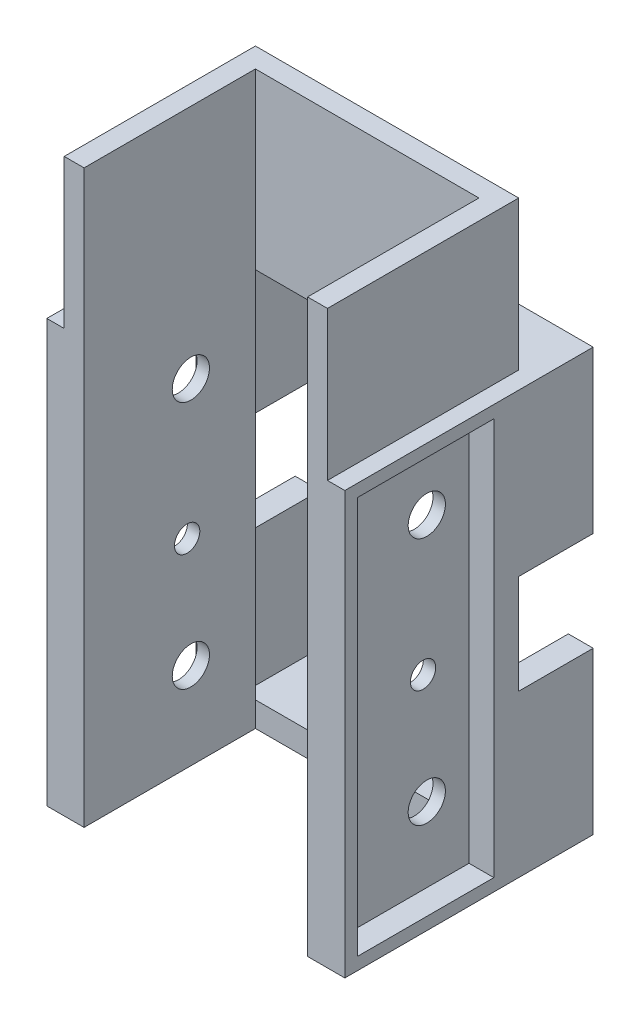
from build123d import *

# Parameters (mm, degrees)
BOSS_EXTRUDE1_DEPTH     = 60
CUT_EXTRUDE2_DEPTH      = 10
SKETCH4_R               = 1.5
CUT_EXTRUDE3_DEPTH      = 145.308696897
CUT_EXTRUDE4_DEPTH      = 188.082869339
CUT_EXTRUDE4_DEPTH_BACK = 188.082869339
SKETCH6_W               = 5
SKETCH6_H               = 59
BOSS_EXTRUDE2_DEPTH     = 150
SKETCH7_R               = 7.5
SKETCH7_R_2             = 5.1
CUT_EXTRUDE5_DEPTH      = 148.732867027
SKETCH9_W               = 40
SKETCH9_H               = 10
CUT_EXTRUDE6_DEPTH      = 188.082869339
SKETCH11_W              = 10
SKETCH11_H              = 40
BOSS_EXTRUDE6_DEPTH     = 160
SKETCH13_W              = 40
SKETCH13_H              = 30
CUT_EXTRUDE7_DEPTH      = 156.32224567
BOSS_EXTRUDE7_DEPTH     = 60


with BuildPart() as part:
    # Sketch1 → Boss-Extrude1 (new, symmetric)
    with BuildSketch(Plane.YZ):
        Polygon((85, 50), (85, -50), (75, -50), (75, 40), (-75, 40), (-75, -50), (-85, -50), (-85, 50), align=None)
    extrude(amount=BOSS_EXTRUDE1_DEPTH, both=True)

    # Sketch3 → Cut-Extrude2 (cut)
    with BuildSketch(Plane.YZ.offset(60)):
        Polygon((-80, 45), (-80, -50), (-75, -50), (-75, 40), (75, 40), (75, -50), (80, -50), (80, 45), align=None)
    cut_extrude2 = extrude(amount=-CUT_EXTRUDE2_DEPTH, mode=Mode.SUBTRACT)

    # Mirror1: Cut-Extrude2 across plane
    add(cut_extrude2.mirror(Plane(origin=(0, 0, 0), x_dir=(0, 0, 1), z_dir=(1, 0, 0))), mode=Mode.SUBTRACT)

    # Sketch4 → Cut-Extrude3 (cut, through all)
    with BuildSketch(Plane.XY.offset(50)):
        with Locations((-35, 0)):
            Circle(SKETCH4_R)
        with Locations((35, 0)):
            Circle(SKETCH4_R)
        with Locations((-35, 60)):
            Circle(SKETCH4_R)
        with Locations((35, 60)):
            Circle(SKETCH4_R)
    extrude(amount=-CUT_EXTRUDE3_DEPTH, mode=Mode.SUBTRACT)

    # Sketch5 → Cut-Extrude4 (cut, two sides: drawn at the far end of the back side and taken through both)
    with BuildSketch(Plane(origin=(0, 85, 0), x_dir=(-1, 0, 0), z_dir=(0, 1, 0)).offset(-CUT_EXTRUDE4_DEPTH_BACK)):
        Polygon((45, 50), (-45, 50), (-45, -19), (20, -19), (45, -19), align=None)
    extrude(amount=CUT_EXTRUDE4_DEPTH + CUT_EXTRUDE4_DEPTH_BACK, mode=Mode.SUBTRACT)

    # Sketch6 → Boss-Extrude2 (add)
    with BuildSketch(Plane.XZ.offset(-75)):
        with Locations((-47.5, 10.5)):
            Rectangle(SKETCH6_W, SKETCH6_H)
        with Locations((47.5, 10.5)):
            Rectangle(SKETCH6_W, SKETCH6_H)
    extrude(amount=BOSS_EXTRUDE2_DEPTH)

    # Sketch7 → Cut-Extrude5 (cut, through all)
    with BuildSketch(Plane(origin=(-50, 0, 0), x_dir=(0, -1, 0), z_dir=(-1, 0, 0))):
        with Locations(Location((-50, 7, 0), (0, 0, 90))):
            Circle(SKETCH7_R)
        with Locations(Location((5, 8.5, 0), (0, 0, 90))):
            Circle(SKETCH7_R_2)
        with Locations(Location((50, 7, 0), (0, 0, 90))):
            Circle(SKETCH7_R)
    extrude(amount=-CUT_EXTRUDE5_DEPTH, mode=Mode.SUBTRACT)

    # Sketch9 → Cut-Extrude6 (cut, through all)
    with BuildSketch(Plane(origin=(0, 85, 0), x_dir=(-1, 0, 0), z_dir=(0, 1, 0))):
        with Locations((0, -45)):
            Rectangle(SKETCH9_W, SKETCH9_H)
    extrude(amount=-CUT_EXTRUDE6_DEPTH, mode=Mode.SUBTRACT)

    # Sketch11 → Boss-Extrude6 (add)
    with BuildSketch(Plane(origin=(0, -80, 0), x_dir=(-1, 0, 0), z_dir=(0, 1, 0))):
        with Locations((-55, -30)):
            Rectangle(SKETCH11_W, SKETCH11_H)
        with Locations((55, -30)):
            Rectangle(SKETCH11_W, SKETCH11_H)
    extrude(amount=BOSS_EXTRUDE6_DEPTH)

    # Sketch13 → Cut-Extrude7 (cut, through all)
    with BuildSketch(Plane(origin=(-60, 0, 0), x_dir=(0, -1, 0), z_dir=(-1, 0, 0))):
        with Locations((0, -35)):
            Rectangle(SKETCH13_W, SKETCH13_H)
    extrude(amount=-CUT_EXTRUDE7_DEPTH, mode=Mode.SUBTRACT)

    # Sketch14 → Boss-Extrude7 (add)
    with BuildSketch(Plane(origin=(0, 85, 0), x_dir=(-1, 0, 0), z_dir=(0, 1, 0))):
        Polygon((-45, 50), (-53, 50), (-53, -27), (-44.583399228, -27), (53, -27), (53, -19), (53, 50), (45, 50), (45, -19), (-45, -19), align=None)
    extrude(amount=BOSS_EXTRUDE7_DEPTH)


solid = part.part
